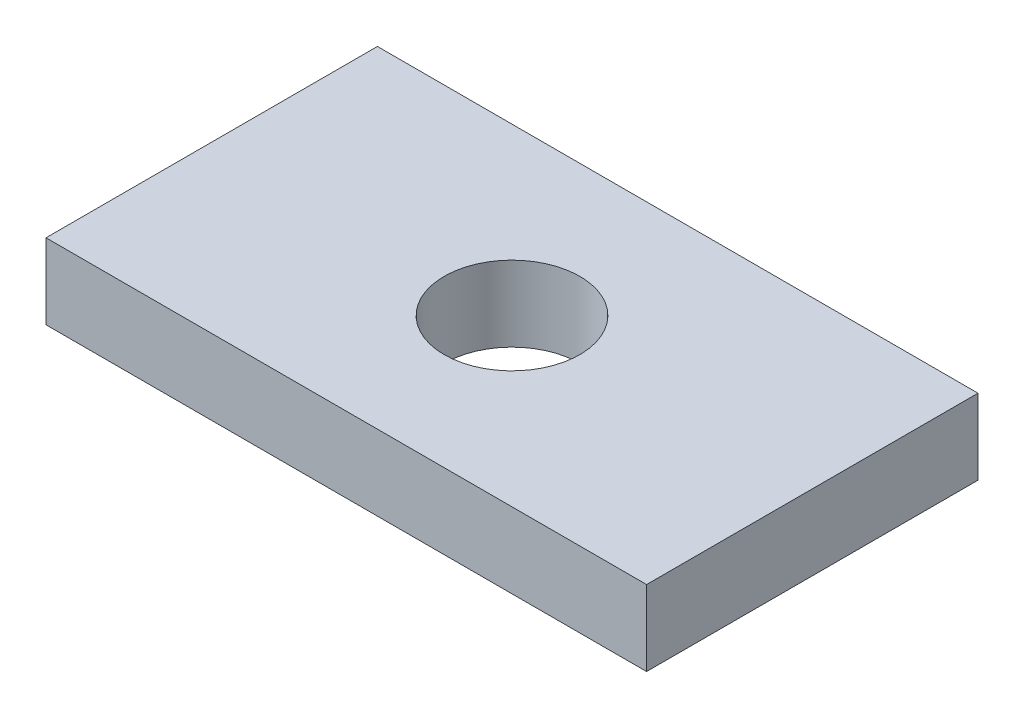
from build123d import *

# Parameters (mm, degrees)
SKETCH_1_W          = 79.688684703
SKETCH_1_H          = 43.973938877
EXTRUDE_1_DEPTH     = 10
SKETCH_2_R          = 9
CUT_EXTRUDE_1_DEPTH = 92.564151118


with BuildPart() as part:
    # Эскиз1 → Вытянуть1 (new body)
    with BuildSketch(Plane(origin=(0, 0, 0), x_dir=(1, 0, 0), z_dir=(0, 1, 0))):
        with Locations((39.844342352, -21.986969439)):
            Rectangle(SKETCH_1_W, SKETCH_1_H)
    extrude(amount=EXTRUDE_1_DEPTH)

    # Эскиз2 → Вырез-Вытянуть1 (cut, through all)
    with BuildSketch(Plane(origin=(0, 10, 0), x_dir=(1, 0, 0), z_dir=(0, 1, 0))):
        with Locations(Location((39.844342351, -21.986969438, 0), (0, 0, 270))):
            Circle(SKETCH_2_R)
    extrude(amount=-CUT_EXTRUDE_1_DEPTH, mode=Mode.SUBTRACT)


solid = part.part
